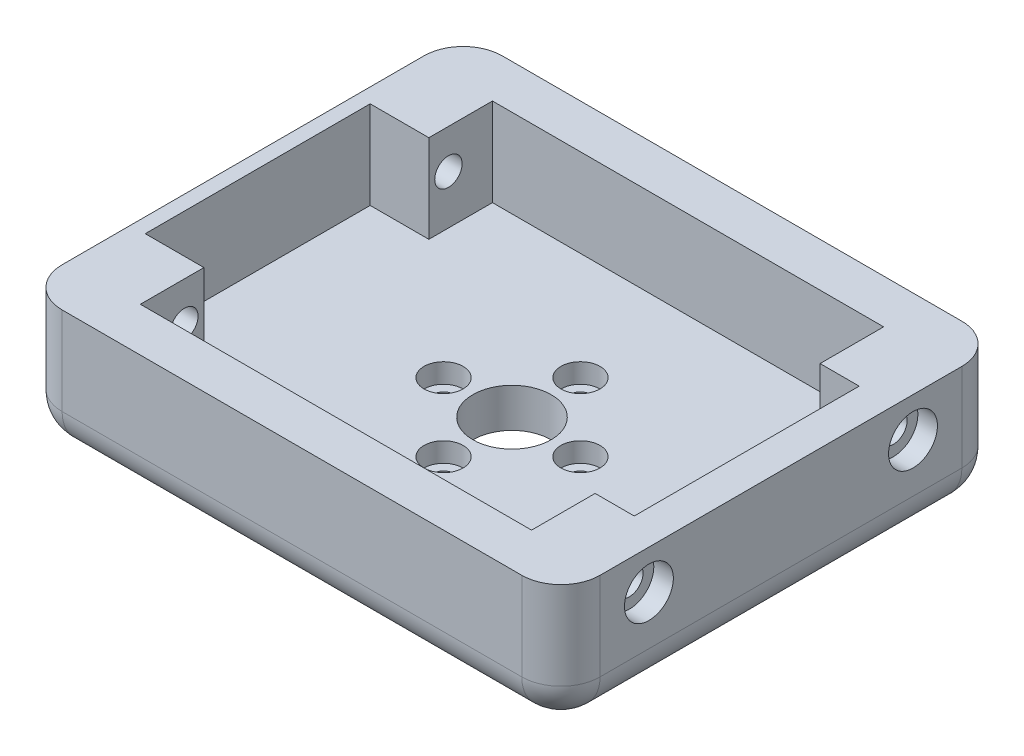
from build123d import *

# Parameters (mm, degrees)
SKETCH1_W           = 55
SKETCH1_H           = 45
BOSS_EXTRUDE1_DEPTH = 13
SKETCH2_W           = 40
SKETCH2_H           = 36
SKETCH2_W_2         = 6
SKETCH2_H_2         = 23
SKETCH2_W_3         = 4
CUT_EXTRUDE1_DEPTH  = 9
SKETCH3_R           = 1.4
CUT_EXTRUDE2_DEPTH  = 61.829680256
SKETCH4_R           = 1.05
SKETCH4_R_2         = 4
CUT_EXTRUDE3_DEPTH  = 37.653785616
SKETCH5_R           = 2
CUT_EXTRUDE4_DEPTH  = 2
SKETCH6_R           = 2.5
CUT_EXTRUDE5_DEPTH  = 1.4
CUT_EXTRUDE6_START  = -2
SKETCH7_R           = 2.5
CUT_EXTRUDE6_DEPTH  = 2
FILLET1_R           = 4


with BuildPart() as part:
    # Sketch1 → Boss-Extrude1 (new body)
    with BuildSketch(Plane(origin=(0, 0, 0), x_dir=(1, 0, 0), z_dir=(0, 1, 0))):
        Rectangle(SKETCH1_W, SKETCH1_H)
    extrude(amount=BOSS_EXTRUDE1_DEPTH)

    # Sketch2 → Cut-Extrude1 (cut)
    with BuildSketch(Plane(origin=(0, 13, 0), x_dir=(1, 0, 0), z_dir=(0, 1, 0))):
        Rectangle(SKETCH2_W, SKETCH2_H)
        with Locations((-23, 0)):
            Rectangle(SKETCH2_W_2, SKETCH2_H_2)
        with Locations((22, 0)):
            Rectangle(SKETCH2_W_3, SKETCH2_H_2)
    extrude(amount=-CUT_EXTRUDE1_DEPTH, mode=Mode.SUBTRACT)

    # Sketch3 → Cut-Extrude2 (cut, through all)
    with BuildSketch(Plane.ZY.offset(27.5)):
        with Locations((-13.5, 9)):
            Circle(SKETCH3_R)
        with Locations((13.5, 9)):
            Circle(SKETCH3_R)
    extrude(amount=-CUT_EXTRUDE2_DEPTH, mode=Mode.SUBTRACT)

    # Sketch4 → Cut-Extrude3 (cut, through all)
    with BuildSketch(Plane(origin=(0, 4, 0), x_dir=(1, 0, 0), z_dir=(0, 1, 0))):
        with Locations(Location((0, 7, 0), (0, 0, 270))):
            Circle(SKETCH4_R)
        with Locations(Location((7, 0, 0), (0, 0, 270))):
            Circle(SKETCH4_R)
        with Locations(Location((-7, 0, 0), (0, 0, 270))):
            Circle(SKETCH4_R)
        with Locations(Location((0, -7, 0), (0, 0, 270))):
            Circle(SKETCH4_R)
        with Locations(Location((0, 0, 0), (0, 0, 270))):
            Circle(SKETCH4_R_2)
    extrude(amount=-CUT_EXTRUDE3_DEPTH, mode=Mode.SUBTRACT)

    # Sketch5 → Cut-Extrude4 (cut)
    with BuildSketch(Plane(origin=(0, 4, 0), x_dir=(1, 0, 0), z_dir=(0, 1, 0))):
        with Locations(Location((-7, 0, 0), (0, 0, 270))):
            Circle(SKETCH5_R)
        with Locations(Location((0, 7, 0), (0, 0, 270))):
            Circle(SKETCH5_R)
        with Locations(Location((7, 0, 0), (0, 0, 270))):
            Circle(SKETCH5_R)
        with Locations(Location((0, -7, 0), (0, 0, 270))):
            Circle(SKETCH5_R)
    extrude(amount=-CUT_EXTRUDE4_DEPTH, mode=Mode.SUBTRACT)

    # Sketch6 → Cut-Extrude5 (cut)
    with BuildSketch(Plane.ZY.offset(27.5)):
        with Locations((-13.5, 9)):
            Circle(SKETCH6_R)
        with Locations((13.5, 9)):
            Circle(SKETCH6_R)
    extrude(amount=-CUT_EXTRUDE5_DEPTH, mode=Mode.SUBTRACT)

    # Sketch7 → Cut-Extrude6 (cut)
    with BuildSketch(Plane(origin=(27.5, 0, 0), x_dir=(0, 0, -1), z_dir=(1, 0, 0)).offset(CUT_EXTRUDE6_START)):
        with Locations(Location((-13.5, 9, 0), (0, 0, 180))):
            Circle(SKETCH7_R)
        with Locations(Location((13.5, 9, 0), (0, 0, 180))):
            Circle(SKETCH7_R)
    extrude(amount=CUT_EXTRUDE6_DEPTH, mode=Mode.SUBTRACT)

    # Fillet1
    fillet1_edges = [part.edges().sort_by_distance(p)[0] for p in [
        (0, 0, -22.5),
        (27.5, 0, 0),
        (0, 0, 22.5),
        (-27.5, 0, 0),
        (-27.5, 6.5, -22.5),
        (27.5, 6.5, -22.5),
        (27.5, 6.5, 22.5),
        (-27.5, 6.5, 22.5),
    ]]
    fillet(fillet1_edges, radius=FILLET1_R)


solid = part.part
